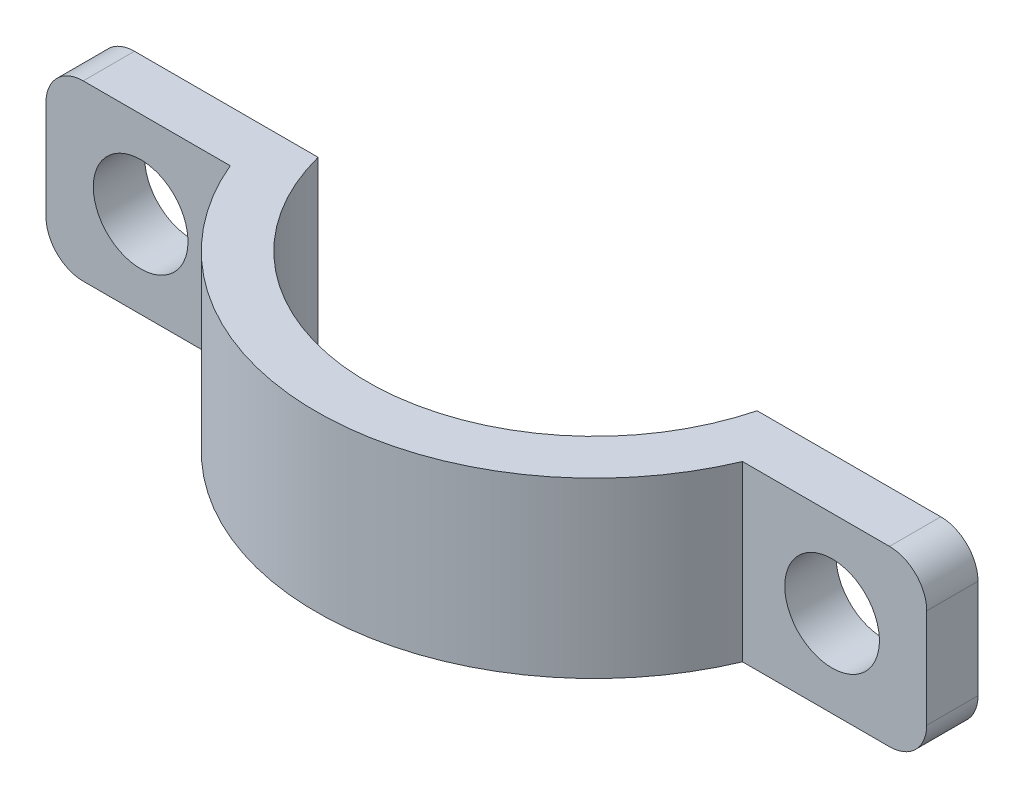
from build123d import *

# Parameters (mm, degrees)
BOSS_EXTRUDE1_DEPTH = 11
SKETCH2_R           = 3
CUT_EXTRUDE1_DEPTH  = 30
CUT_EXTRUDE2_DEPTH  = 20
FILLET1_R           = 2.36


with BuildPart() as part:
    # Sketch1 → Boss-Extrude1 (new body)
    with BuildSketch(Plane(origin=(0, 0, 0), x_dir=(1, 0, 0), z_dir=(0, 1, 0))):
        with BuildLine():
            Line((-27.916231576, -22.71939994), (27.916231576, -22.71939994))
            Line((27.916231576, -22.71939994), (27.916231576, -3.602655093))
            Line((27.916231576, -3.602655093), (13.916231576, -3.602655093))
            ThreePointArc((13.916231576, -3.602655093), (0, -14.375), (-13.916231576, -3.602655093))
            Line((-13.916231576, -3.602655093), (-27.916231576, -3.602655093))
            Line((-27.916231576, -3.602655093), (-27.916231576, -22.71939994))
        make_face()
    extrude(amount=BOSS_EXTRUDE1_DEPTH)

    # Sketch2 → Cut-Extrude1 (cut)
    with BuildSketch(Plane(origin=(0, 0, 3.602655093), x_dir=(-1, 0, 0), z_dir=(0, 0, -1))):
        with Locations((21.916231576, 5.5)):
            Circle(SKETCH2_R)
        with Locations((-21.916231576, 5.5)):
            Circle(SKETCH2_R)
    extrude(amount=-CUT_EXTRUDE1_DEPTH, mode=Mode.SUBTRACT)

    # Sketch4 → Cut-Extrude2 (cut)
    with BuildSketch(Plane.XZ):
        with BuildLine():
            Line((27.916231576, 6.852655093), (27.916231576, 7.602655093))
            Line((27.916231576, 7.602655093), (27.916231576, 22.71939994))
            Line((27.916231576, 22.71939994), (-27.916231576, 22.71939994))
            Line((-27.916231576, 22.71939994), (-27.916231576, 7.602655093))
            Line((-27.916231576, 7.602655093), (-27.916231576, 6.852655093))
            Line((-27.916231576, 6.852655093), (-16.238280179, 6.852655093))
            ThreePointArc((-16.238280179, 6.852655093), (0, 17.625), (16.238280179, 6.852655093))
            Line((16.238280179, 6.852655093), (27.916231576, 6.852655093))
        make_face()
    extrude(amount=-CUT_EXTRUDE2_DEPTH, mode=Mode.SUBTRACT)

    # Fillet1
    fillet1_edges = [part.edges().sort_by_distance(p)[0] for p in [
        (27.916231576, 0, 5.227655093),
        (27.916231576, 11, 5.227655093),
        (-27.916231576, 11, 5.227655093),
        (-27.916231576, 0, 5.227655093),
    ]]
    fillet(fillet1_edges, radius=FILLET1_R)


solid = part.part
